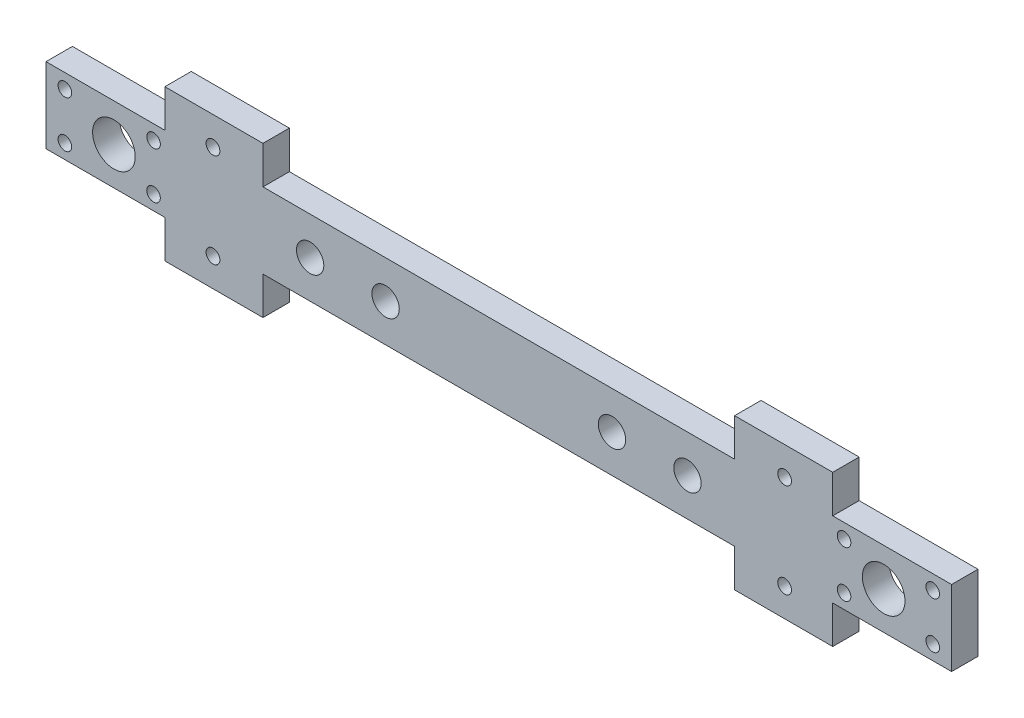
from build123d import *

# Parameters (mm, degrees)
BOSS_EXTRUDE1_DEPTH = 14
SKETCH3_R           = 11.3
SKETCH3_R_2         = 3.6
SKETCH3_R_3         = 3.65
SKETCH3_R_4         = 7.25
CUT_EXTRUDE1_DEPTH  = 14


with BuildPart() as part:
    # Sketch2 → Boss-Extrude1 (new body)
    with BuildSketch(Plane.XY):
        Polygon((-56.968136793, -20), (-56.968136793, 20), (6.031863207, 20), (6.031863207, 40), (58.031863207, 40), (58.031863207, 20), (308.031863207, 20), (308.031863207, 40), (360.031863207, 40), (360.031863207, 20), (423.031863207, 20), (423.031863207, -20), (360.031863207, -20), (360.031863207, -40), (308.031863207, -40), (308.031863207, -20), (58.031863207, -20), (58.031863207, -40), (6.031863207, -40), (6.031863207, -20), align=None)
    extrude(amount=BOSS_EXTRUDE1_DEPTH)

    # Sketch3 → Cut-Extrude1 (cut)
    with BuildSketch(Plane.XY.offset(14)):
        with Locations((-20.968136793, 0)):
            Circle(SKETCH3_R)
        with Locations((-46.968136793, 12.35)):
            Circle(SKETCH3_R_2)
        with Locations((0.031863207, 12.35)):
            Circle(SKETCH3_R_2)
        with Locations(Location((0.031863207, -12.35, 0), (0, 0, 180))):
            Circle(SKETCH3_R_2)
        with Locations(Location((-46.968136793, -12.35, 0), (0, 0, 180))):
            Circle(SKETCH3_R_2)
        with Locations((31.531863207, 25)):
            Circle(SKETCH3_R_3)
        with Locations(Location((31.531863207, -25, 0), (0, 0, 180))):
            Circle(SKETCH3_R_3)
        with Locations((83.031863207, 0)):
            Circle(SKETCH3_R_4)
        with Locations((123.031863207, 0)):
            Circle(SKETCH3_R_4)
        with Locations(Location((283.031863207, 0, 0), (0, 0, 180))):
            Circle(SKETCH3_R_4)
        with Locations(Location((243.031863207, 0, 0), (0, 0, 180))):
            Circle(SKETCH3_R_4)
        with Locations((334.531863207, -25)):
            Circle(SKETCH3_R_3)
        with Locations(Location((334.531863207, 25, 0), (0, 0, 180))):
            Circle(SKETCH3_R_3)
        with Locations((366.031863207, -12.35)):
            Circle(SKETCH3_R_2)
        with Locations(Location((366.031863207, 12.35, 0), (0, 0, 180))):
            Circle(SKETCH3_R_2)
        with Locations(Location((387.031863207, 0, 0), (0, 0, 180))):
            Circle(SKETCH3_R)
        with Locations((413.031863207, -12.35)):
            Circle(SKETCH3_R_2)
        with Locations(Location((413.031863207, 12.35, 0), (0, 0, 180))):
            Circle(SKETCH3_R_2)
    extrude(amount=-CUT_EXTRUDE1_DEPTH, mode=Mode.SUBTRACT)


solid = part.part
